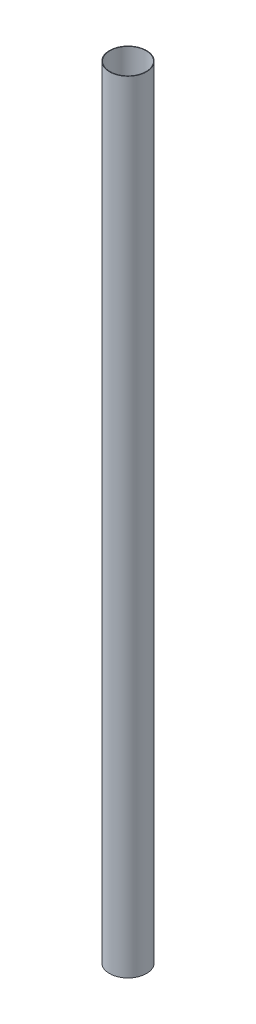
from build123d import *

# Parameters (mm, degrees)
SKETCH2_R   = 76
SKETCH2_R_2 = 74


with BuildPart() as part:
    # Sweep1: sweep along a path in Sketch1
    with BuildLine(Plane.XY) as sweep1_path:
        Line((0, 0), (0, 3200))
    # Sketch2 → Sweep1 (sweep)
    with BuildSketch(Plane(origin=(0, 0, 0), x_dir=(1, 0, 0), z_dir=(0, 1, 0))):
        Circle(SKETCH2_R)
        Circle(SKETCH2_R_2, mode=Mode.SUBTRACT)
    sweep(path=sweep1_path.line)


solid = part.part
